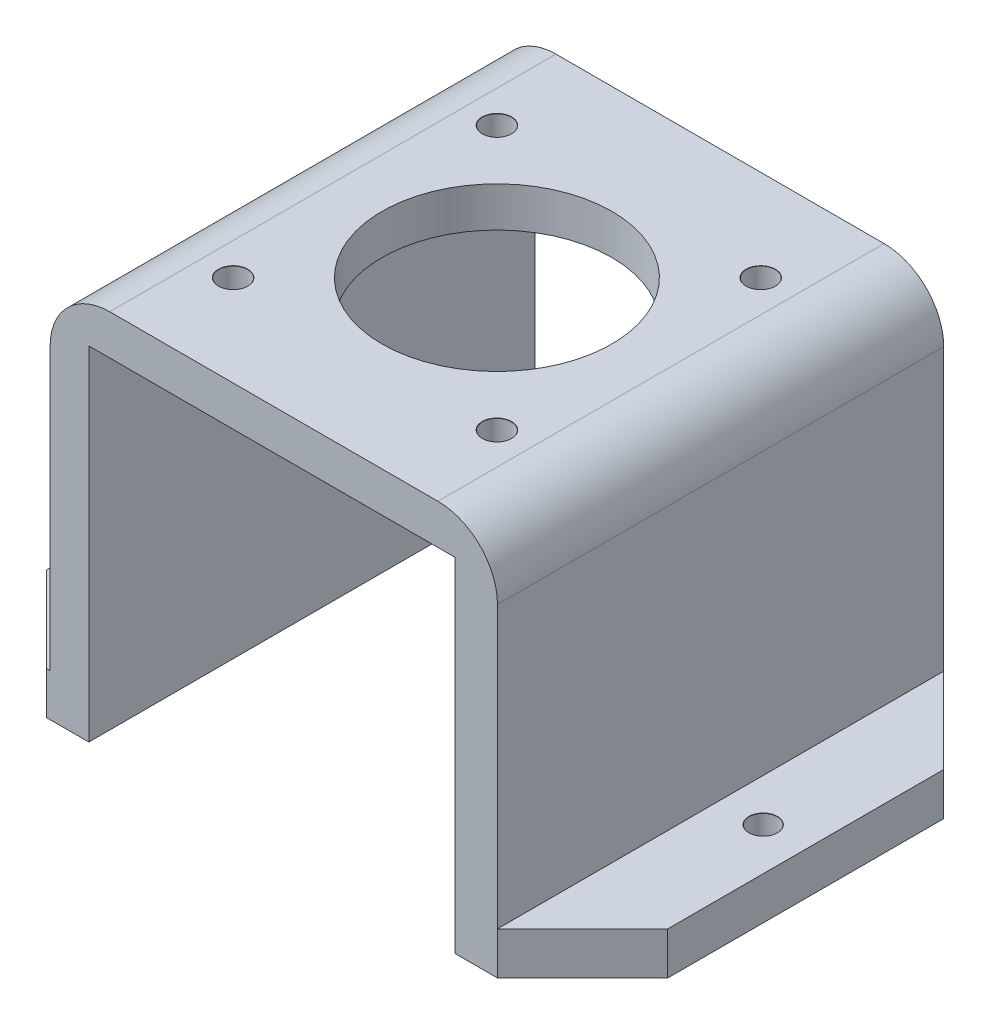
from build123d import *

# Parameters (mm, degrees)
SKETCH1_W                             = 15
SKETCH1_H                             = 52.418
BOSS_EXTRUDE1_DEPTH                   = 45
BOSS_EXTRUDE1_2_DEPTH                 = 45
SKETCH2_W                             = 10.451630362
SKETCH2_H                             = 52.418
SKETCH2_W_2                           = 10
CUT_EXTRUDE1_DEPTH                    = 40
SKETCH3_W                             = 52.418
SKETCH3_H                             = 4.7
BOSS_EXTRUDE3_DEPTH                   = 44
M3_CLEARANCE_HOLE1_D                  = 3.4
M3_CLEARANCE_HOLE1_CSINK_D            = 3.45
M3_CLEARANCE_HOLE1_CSINK_ANGLE        = 90
SKETCH4_R                             = 13.5
CUT_EXTRUDE2_DEPTH                    = 44
TAP_DRILL_FOR_M4X0_7_TAP1_D           = 3.3
TAP_DRILL_FOR_M4X0_7_TAP1_CSINK_D     = 3.35
TAP_DRILL_FOR_M4X0_7_TAP1_CSINK_ANGLE = 90
CHAMFER1_SIZE                         = 10
FILLET1_R                             = 7


with BuildPart() as part:
    # Sketch1 → Boss-Extrude1 (new body)
    with BuildSketch(Plane(origin=(0, 0, 0), x_dir=(1, 0, 0), z_dir=(0, 1, 0))):
        with Locations((7.5, 26.209)):
            Rectangle(SKETCH1_W, SKETCH1_H)
    extrude(amount=BOSS_EXTRUDE1_DEPTH)


with BuildPart() as body_2:
    # Sketch1 → Boss-Extrude1 2 (new body)
    with BuildSketch(Plane(origin=(0, 0, 0), x_dir=(1, 0, 0), z_dir=(0, 1, 0))):
        with Locations((-50.5, 26.209)):
            Rectangle(SKETCH1_W, SKETCH1_H)
    extrude(amount=BOSS_EXTRUDE1_2_DEPTH)


with BuildPart() as cut_extrude1_tool:
    # Sketch2 → Cut-Extrude1 (new body)
    with BuildSketch(Plane(origin=(0, 45, 0), x_dir=(1, 0, 0), z_dir=(0, 1, 0))):
        with Locations((-52.774184819, 26.209)):
            Rectangle(SKETCH2_W, SKETCH2_H)
        with Locations((10, 26.209)):
            Rectangle(SKETCH2_W_2, SKETCH2_H)
    extrude(amount=-CUT_EXTRUDE1_DEPTH)


with BuildPart() as part_1:
    add(part.part)

    # Cut-Extrude1: cut by cut_extrude1_tool
    add(cut_extrude1_tool.part, mode=Mode.SUBTRACT)



with BuildPart() as body_2_1:
    add(body_2.part)

    # Cut-Extrude1: cut by cut_extrude1_tool
    add(cut_extrude1_tool.part, mode=Mode.SUBTRACT)


with BuildPart() as part_2:
    add(part_1.part)

    add(body_2_1.part)  # Boss-Extrude3 merges body 2
    # Sketch3 → Boss-Extrude3 (add)
    with BuildSketch(Plane.ZY):
        with Locations((-26.209, 42.65)):
            Rectangle(SKETCH3_W, SKETCH3_H)
    extrude(amount=BOSS_EXTRUDE3_DEPTH)

    # M3 Clearance Hole1 (through all)
    with Locations(Plane(origin=(0, 45, 0), x_dir=(1, 0, 0), z_dir=(0, 1, 0))):
        with Locations((-36.768184819, 41.703), (-5.780184819, 41.703), (-5.780184819, 10.715), (-36.768184819, 10.715)):
            CounterSinkHole(M3_CLEARANCE_HOLE1_D / 2, M3_CLEARANCE_HOLE1_CSINK_D / 2, counter_sink_angle=M3_CLEARANCE_HOLE1_CSINK_ANGLE)

    # Sketch4 → Cut-Extrude2 (cut)
    with BuildSketch(Plane(origin=(0, 45, 0), x_dir=(1, 0, 0), z_dir=(0, 1, 0))):
        with Locations(Location((-21.274184819, 26.209, 0), (0, 0, 270))):
            Circle(SKETCH4_R)
    extrude(amount=-CUT_EXTRUDE2_DEPTH, mode=Mode.SUBTRACT)

    # Tap Drill for M4x0.7 Tap1 (through all)
    with Locations(Plane(origin=(0, 5, 0), x_dir=(1, 0, 0), z_dir=(0, 1, 0))):
        with Locations((-52.774184819, 26.209), (10, 26.209)):
            CounterSinkHole(TAP_DRILL_FOR_M4X0_7_TAP1_D / 2, TAP_DRILL_FOR_M4X0_7_TAP1_CSINK_D / 2, counter_sink_angle=TAP_DRILL_FOR_M4X0_7_TAP1_CSINK_ANGLE)

    # Chamfer1
    chamfer1_edges = [part_2.edges().sort_by_distance(p)[0] for p in [
        (15, 2.5, -52.418),
        (15, 2.5, 0),
        (-58, 2.5, 0),
        (-58, 2.5, -52.418),
    ]]
    chamfer(chamfer1_edges, length=CHAMFER1_SIZE)

    # Fillet1
    fillet1_edges = [part_2.edges().sort_by_distance(p)[0] for p in [
        (5, 45, -26.209),
        (-47.548369638, 45, -26.209),
    ]]
    fillet(fillet1_edges, radius=FILLET1_R)


solid = part_2.part
